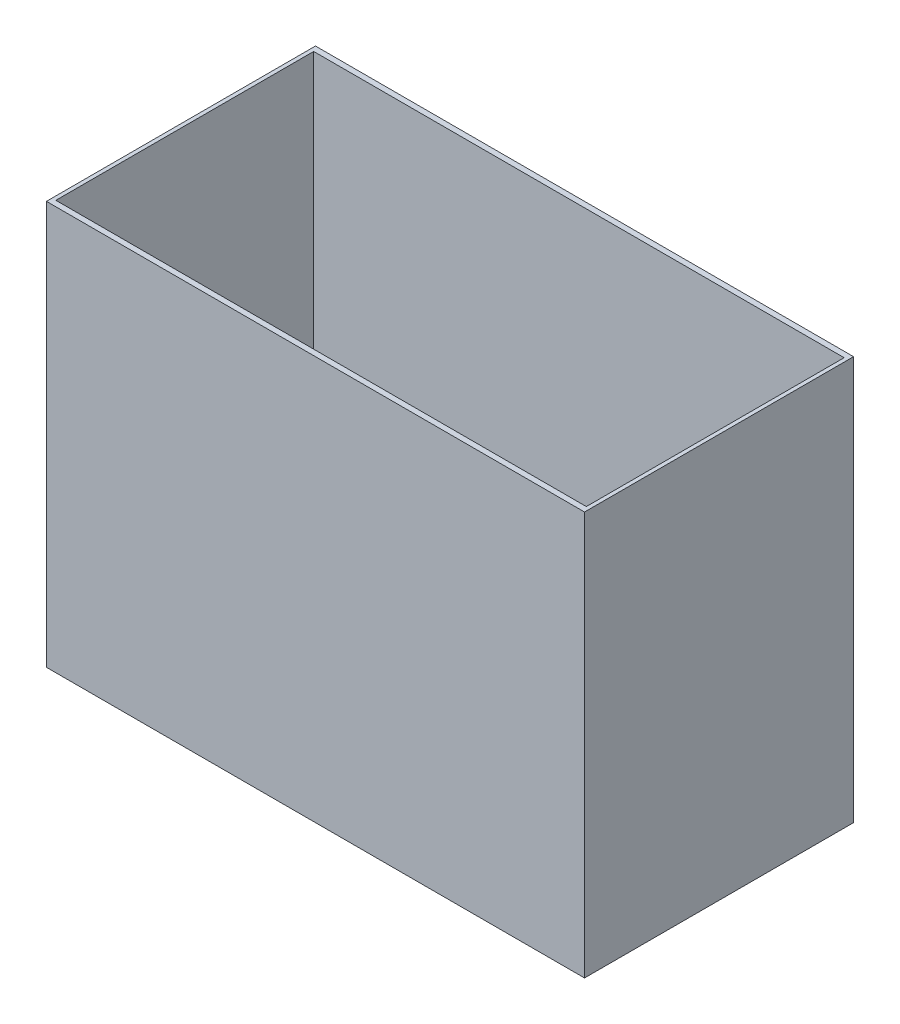
from build123d import *

# Parameters (mm, degrees)
SKETCH1_W           = 584.2
SKETCH1_H           = 279.4
BOSS_EXTRUDE1_DEPTH = 12.7
SKETCH3_W           = 609.6
SKETCH3_H           = 304.8
SKETCH3_W_2         = 600.964
SKETCH3_H_2         = 292.1
BOSS_EXTRUDE3_DEPTH = 457.2
SKETCH4_R           = 2.778125
CUT_EXTRUDE1_DEPTH  = 561.097357608


with BuildPart() as part:
    # Sketch1 → Boss-Extrude1 (new body)
    with BuildSketch(Plane(origin=(0, 0, 0), x_dir=(1, 0, 0), z_dir=(0, 1, 0))):
        Rectangle(SKETCH1_W, SKETCH1_H)
    extrude(amount=BOSS_EXTRUDE1_DEPTH)

    # Sketch4 → Cut-Extrude1 (cut, through all)
    with BuildSketch(Plane(origin=(0, 12.7, 0), x_dir=(1, 0, 0), z_dir=(0, 1, 0))):
        with Locations(Location((254, 101.6, 0), (0, 0, 270))):
            Circle(SKETCH4_R)
    cut_extrude1 = extrude(amount=-CUT_EXTRUDE1_DEPTH, mode=Mode.SUBTRACT)

    # Mirror1: Cut-Extrude1 across plane
    add(cut_extrude1.mirror(Plane.XY), mode=Mode.SUBTRACT)


with BuildPart() as body_2:
    # Sketch3 → Boss-Extrude3 (new body)
    with BuildSketch(Plane(origin=(0, 0, 0), x_dir=(1, 0, 0), z_dir=(0, 1, 0))):
        Rectangle(SKETCH3_W, SKETCH3_H)
        Rectangle(SKETCH3_W_2, SKETCH3_H_2, mode=Mode.SUBTRACT)
    extrude(amount=BOSS_EXTRUDE3_DEPTH)


solid = Compound([part.part, body_2.part])
